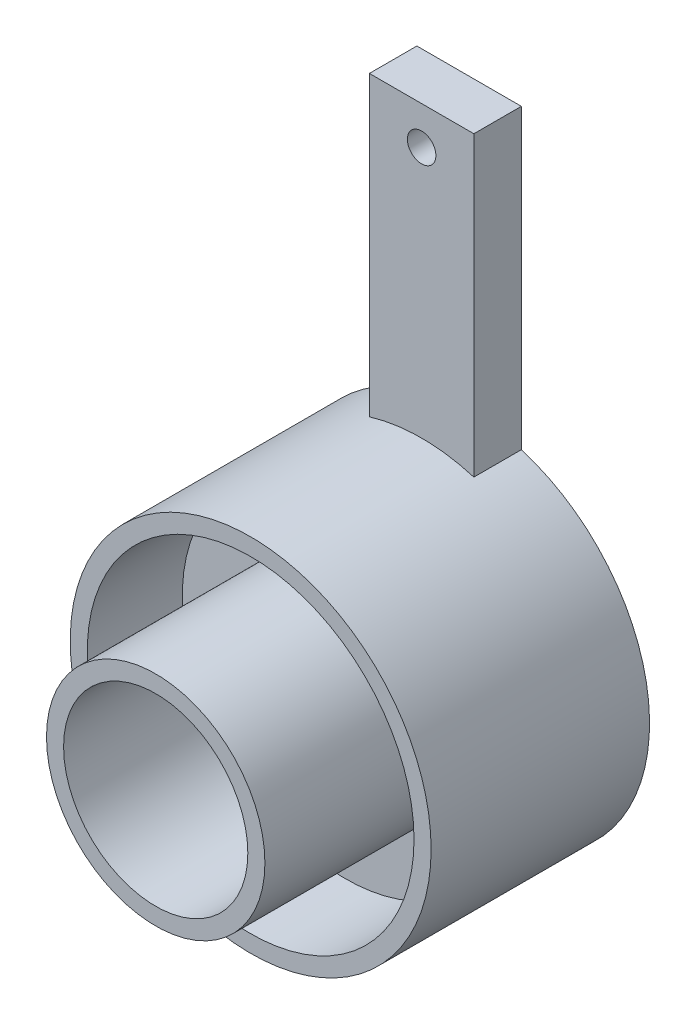
from build123d import *

# Parameters (mm, degrees)
CROQUIS1_R              = 19
SALIENTE_EXTRUIR1_DEPTH = 23
CROQUIS2_R              = 17.2
CORTAR_EXTRUIR1_DEPTH   = 10
CROQUIS3_R              = 11.5
CROQUIS3_R_2            = 9.7
SALIENTE_EXTRUIR2_DEPTH = 20
CORTAR_EXTRUIR3_START   = -10
CROQUIS4_R              = 17.2
CORTAR_EXTRUIR3_DEPTH   = 10
SALIENTE_EXTRUIR3_START = 10
CROQUIS5_R              = 11.5
CROQUIS5_R_2            = 9.7
SALIENTE_EXTRUIR3_DEPTH = 10
SALIENTE_EXTRUIR4_DEPTH = 5.5
SALIENTE_EXTRUIR5_START = -2.4
SALIENTE_EXTRUIR5_DEPTH = 2.4
CROQUIS8_R              = 1.5
CORTAR_EXTRUIR4_DEPTH   = 63.451981554


with BuildPart() as part:
    # Croquis1 → Saliente-Extruir1 (new body)
    with BuildSketch(Plane.XY):
        Circle(CROQUIS1_R)
    extrude(amount=SALIENTE_EXTRUIR1_DEPTH)

    # Croquis2 → Cortar-Extruir1 (cut)
    with BuildSketch(Plane.XY.offset(23)):
        Circle(CROQUIS2_R)
    extrude(amount=-CORTAR_EXTRUIR1_DEPTH, mode=Mode.SUBTRACT)

    # Croquis3 → Saliente-Extruir2 (add)
    with BuildSketch(Plane.XY.offset(13)):
        Circle(CROQUIS3_R)
        Circle(CROQUIS3_R_2, mode=Mode.SUBTRACT)
    extrude(amount=SALIENTE_EXTRUIR2_DEPTH)

    # Croquis4 → Cortar-Extruir3 (cut)
    with BuildSketch(Plane(origin=(0, 0, 0), x_dir=(-1, 0, 0), z_dir=(0, 0, -1)).offset(CORTAR_EXTRUIR3_START)):
        with Locations(Location((0, 0, 0), (0, 0, 180))):
            Circle(CROQUIS4_R)
    extrude(amount=CORTAR_EXTRUIR3_DEPTH, mode=Mode.SUBTRACT)

    # Croquis5 → Saliente-Extruir3 (add)
    with BuildSketch(Plane(origin=(0, 0, 10), x_dir=(-1, 0, 0), z_dir=(0, 0, -1)).offset(SALIENTE_EXTRUIR3_START)):
        with Locations(Location((0, 0, 0), (0, 0, 180))):
            Circle(CROQUIS5_R)
        with Locations(Location((0, 0, 0), (0, 0, 180))):
            Circle(CROQUIS5_R_2, mode=Mode.SUBTRACT)
    extrude(amount=-SALIENTE_EXTRUIR3_DEPTH)

    # Croquis6 → Saliente-Extruir4 (add, symmetric)
    with BuildSketch(Plane(origin=(0, 0, 0), x_dir=(0, 0, -1), z_dir=(1, 0, 0))):
        Polygon((-5, 10.008599435), (0, 10.008599435), (0, 10.702416301), (0, 11.5), (0, 49.5), (-5, 49.5), (-5, 11.5), (-5, 10.702416301), align=None)
    extrude(amount=SALIENTE_EXTRUIR4_DEPTH, both=True)

    # Croquis7 → Saliente-Extruir5 (add)
    with BuildSketch(Plane(origin=(0, 0, 0), x_dir=(-1, 0, 0), z_dir=(0, 0, -1)).offset(SALIENTE_EXTRUIR5_START)):
        with BuildLine():
            Line((-13.053420517, -11.200366637), (-5.966841039, -4.144844594))
            Line((-5.966841039, -4.144844594), (-6.870906384, -2.360841833))
            Line((-6.870906384, -2.360841833), (-16.751201418, -3.903492163))
            ThreePointArc((-16.751201418, -3.903492163), (-15.342423747, -7.774961965), (-13.053420517, -11.200366637))
        make_face()
    extrude(amount=SALIENTE_EXTRUIR5_DEPTH)

    # Croquis8 → Cortar-Extruir4 (cut, through all)
    with BuildSketch(Plane(origin=(0, 0, 0), x_dir=(-1, 0, 0), z_dir=(0, 0, -1))):
        with Locations((0, 45.5)):
            Circle(CROQUIS8_R)
    extrude(amount=-CORTAR_EXTRUIR4_DEPTH, mode=Mode.SUBTRACT)


solid = part.part
